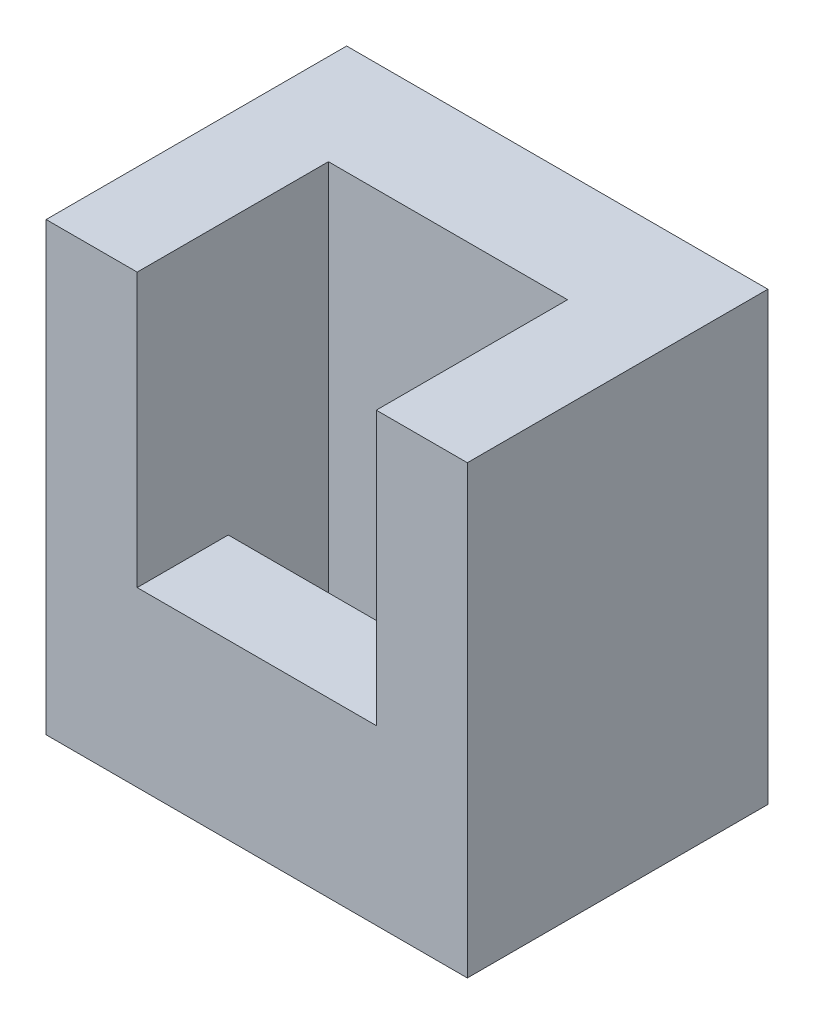
from build123d import *

# Parameters (mm, degrees)
SKETCH1_W           = 23.127
SKETCH1_H           = 16.5
SKETCH1_W_2         = 13.127
SKETCH1_H_2         = 5.5
SKETCH1_W_3         = 2.55
SKETCH1_H_3         = 6
BOSS_EXTRUDE1_DEPTH = 24.5
SKETCH2_W           = 2.55
SKETCH2_H           = 6
CUT_EXTRUDE1_DEPTH  = 2
SKETCH3_W           = 13.127
SKETCH3_H           = 5
CUT_EXTRUDE2_DEPTH  = 15


with BuildPart() as part:
    # Sketch1 → Boss-Extrude1 (new body)
    # profile 1 of 2: a face of its own
    with BuildSketch(Plane(origin=(0, 0, 0), x_dir=(1, 0, 0), z_dir=(0, 1, 0))):
        with Locations((-1.462471661, -2.897695951)):
            Rectangle(SKETCH1_W, SKETCH1_H)
        with Locations((-1.462471661, -3.397695951)):
            Rectangle(SKETCH1_W_2, SKETCH1_H_2, mode=Mode.SUBTRACT)
    # profile 2 of 2: a face of its own
    with BuildSketch(Plane(origin=(0, 0, 0), x_dir=(1, 0, 0), z_dir=(0, 1, 0))):
        with Locations((-1.462471661, 2.352304049)):
            Rectangle(SKETCH1_W_3, SKETCH1_H_3)
    extrude(amount=BOSS_EXTRUDE1_DEPTH)

    # Sketch2 → Cut-Extrude1 (cut)
    with BuildSketch(Plane.XZ):
        with Locations((-1.462471661, -2.352304049)):
            Rectangle(SKETCH2_W, SKETCH2_H)
    extrude(amount=-CUT_EXTRUDE1_DEPTH, mode=Mode.SUBTRACT)

    # Sketch3 → Cut-Extrude2 (cut)
    with BuildSketch(Plane(origin=(0, 24.5, 0), x_dir=(1, 0, 0), z_dir=(0, 1, 0))):
        with Locations((-1.462471661, -8.647695951)):
            Rectangle(SKETCH3_W, SKETCH3_H)
    extrude(amount=-CUT_EXTRUDE2_DEPTH, mode=Mode.SUBTRACT)


solid = part.part
